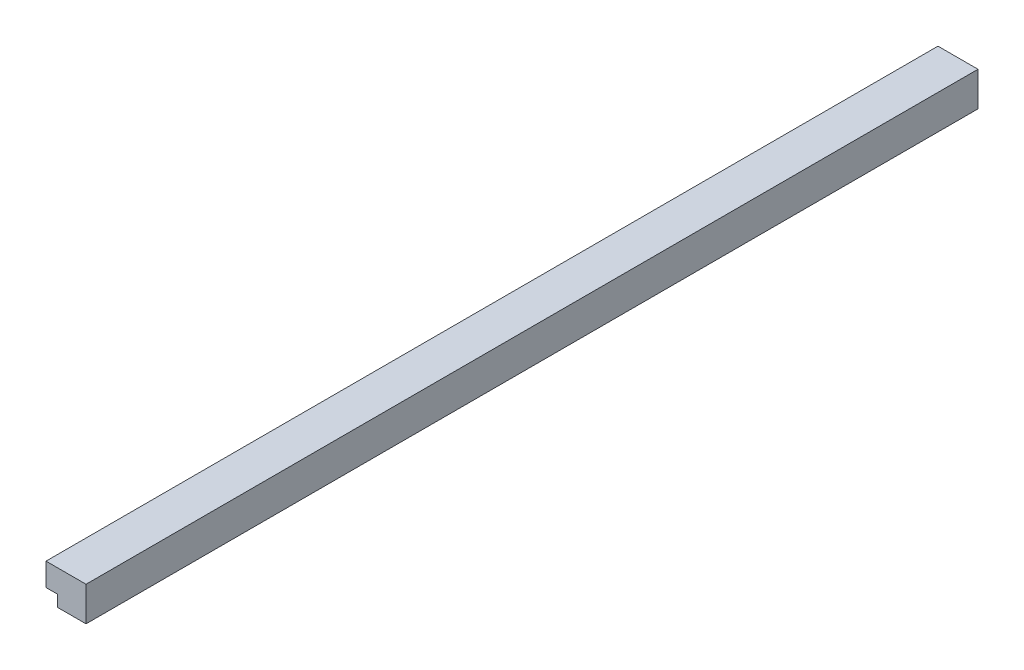
from build123d import *

# Parameters (mm, degrees)
EXTRUDE_1_DEPTH = 780


with BuildPart() as part:
    # Эскиз1 → Бобышка-Вытянуть1 (new body)
    with BuildSketch(Plane(origin=(0, 0, 0), x_dir=(1, 0, 0), z_dir=(0, 0, -1))):
        Polygon((0, 20), (10, 20), (10, 30), (35, 30), (35, 0), (0, 0), align=None)
    extrude(amount=EXTRUDE_1_DEPTH)


solid = part.part
